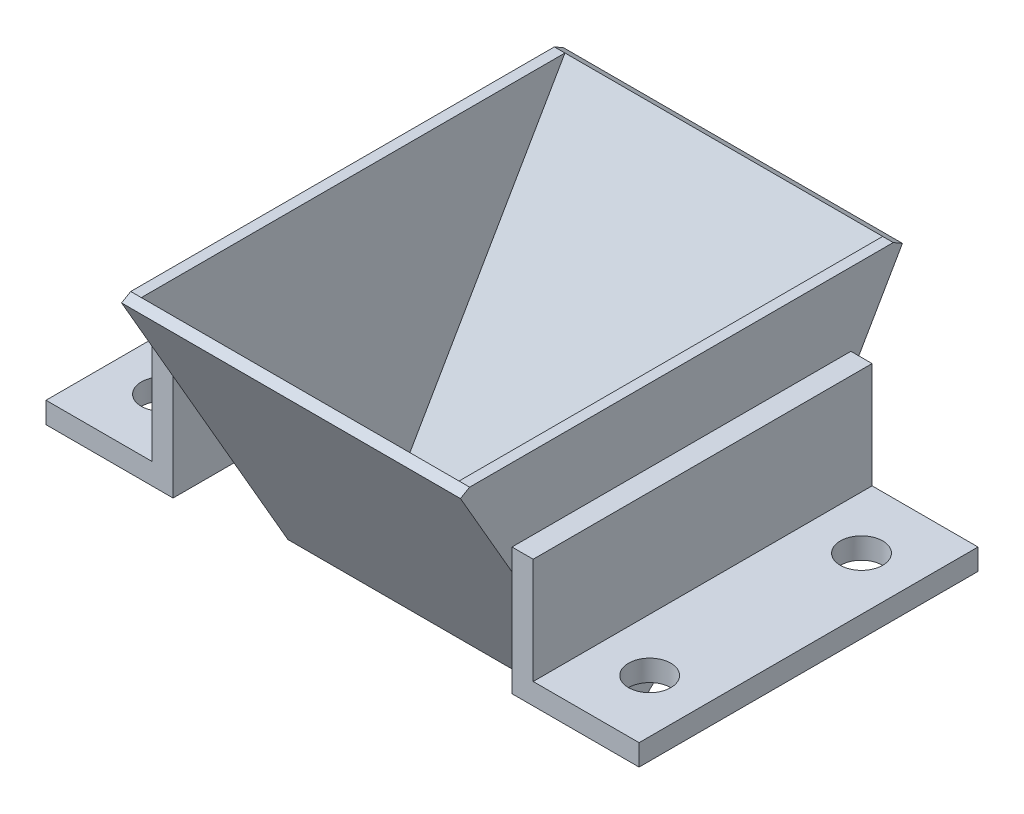
from build123d import *

# Parameters (mm, degrees)
BOSS_EXTRUDE1_DEPTH = 1.5875
SKETCH2_W           = 50.8
SKETCH2_H           = 50.8
BOSS_EXTRUDE2_DEPTH = 1.5875
SKETCH3_W           = 16.36617421
SKETCH3_H           = 0.79375
CUT_EXTRUDE1_DEPTH  = 75.922449176
BOSS_EXTRUDE3_DEPTH = 25.4
SKETCH6_R           = 3.175
CUT_EXTRUDE3_DEPTH  = 81.475374573


with BuildPart() as part:
    # Sketch1 → Boss-Extrude1 (new body)
    with BuildSketch(Plane(origin=(0, 0, 0), x_dir=(0, 0, -1), z_dir=(1, 0, 0))):
        with BuildLine():
            Line((-6.35, 0), (-31.75, 43.994090512))
            Line((-31.75, 43.994090512), (31.75, 43.994090512))
            Line((31.75, 43.994090512), (6.35, 0))
            ThreePointArc((6.35, 0), (0, 6.35), (-6.35, 0))
        make_face()
    boss_extrude1 = extrude(amount=BOSS_EXTRUDE1_DEPTH)

    # Sketch2 → Boss-Extrude2 (add)
    with BuildSketch(Plane(origin=(0, -2.749630657, -4.7625), x_dir=(-1, 0, 0), z_dir=(0, -0.499999999999998, -0.8660254037844397))):
        with Locations((23.8125, 28.575)):
            Rectangle(SKETCH2_W, SKETCH2_H)
    boss_extrude2 = extrude(amount=BOSS_EXTRUDE2_DEPTH)

    # Mirror1: Boss-Extrude2 across plane
    add(boss_extrude2.mirror(Plane.XY))

    # Mirror2: Boss-Extrude1 across plane
    add(boss_extrude1.mirror(Plane(origin=(-23.8125, 0, 0), x_dir=(0, 0, 1), z_dir=(1, 0, 0))))

    # Sketch3 → Cut-Extrude1 (cut, through all)
    with BuildSketch(Plane.ZY.offset(49.2125)):
        with Locations((0, -0.396875)):
            Rectangle(SKETCH3_W, SKETCH3_H)
    extrude(amount=-CUT_EXTRUDE1_DEPTH, mode=Mode.SUBTRACT)

    # Sketch4 → Boss-Extrude3 (add, symmetric)
    with BuildSketch(Plane.XY):
        Polygon((-49.2125, 33.05), (-49.2125, 14), (-68.2625, 14), (-68.2625, 17.175), (-52.3875, 17.175), (-52.3875, 33.05), align=None)
    boss_extrude3 = extrude(amount=BOSS_EXTRUDE3_DEPTH, both=True)

    # Sketch6 → Cut-Extrude3 (cut, through all)
    with BuildSketch(Plane(origin=(0, 17.175, 0), x_dir=(1, 0, 0), z_dir=(0, 1, 0))):
        with Locations(Location((-60.325, 15.875, 0), (0, 0, 270))):
            Circle(SKETCH6_R)
        with Locations(Location((-60.325, -15.875, 0), (0, 0, 270))):
            Circle(SKETCH6_R)
    cut_extrude3 = extrude(amount=-CUT_EXTRUDE3_DEPTH, mode=Mode.SUBTRACT)

    # Mirror3: Boss-Extrude3, Cut-Extrude3 across plane
    add(boss_extrude3.mirror(Plane(origin=(-23.8125, 0, 0), x_dir=(0, 0, 1), z_dir=(1, 0, 0))))
    add(cut_extrude3.mirror(Plane(origin=(-23.8125, 0, 0), x_dir=(0, 0, 1), z_dir=(1, 0, 0))), mode=Mode.SUBTRACT)


solid = part.part
